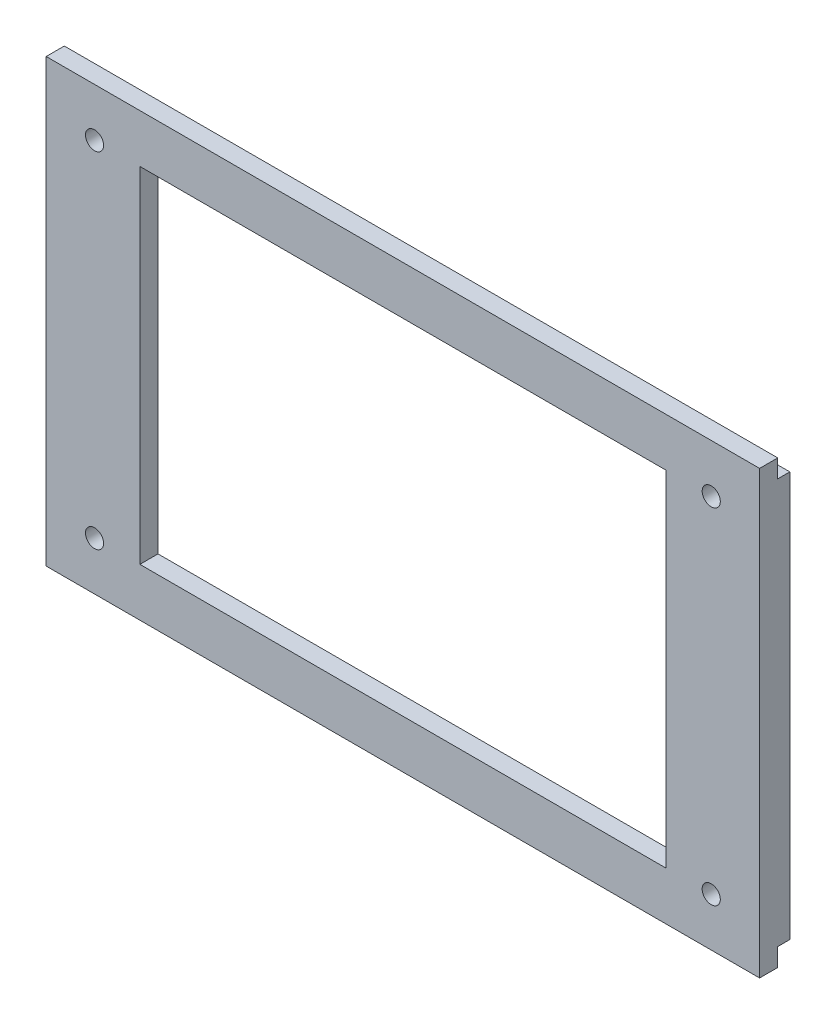
from build123d import *

# Parameters (mm, degrees)
SKETCH_1_R      = 1.5
SKETCH_1_W      = 87
SKETCH_1_H      = 57
EXTRUDE_2_DEPTH = 3
SKETCH_3_W      = 3
SKETCH_3_H      = 67
EXTRUDE_3_DEPTH = 2


with BuildPart() as part:
    # 草图1 → 凸台-拉伸2 (new body)
    with BuildSketch(Plane.XY):
        Polygon((-11.864484676, 21.655738596), (-19.864484676, 21.655738596), (-19.864484676, 10.655738596), (-19.864484676, -51.344261404), (-14.864484676, -51.344261404), (-11.864484676, -51.344261404), (98.135515324, -51.344261404), (98.135515324, -43.344261404), (98.135515324, 10.655738596), (98.135515324, 21.655738596), (-4.364484676, 21.655738596), (-6.864484676, 21.655738596), (-7.364484676, 21.655738596), align=None)
        with Locations((-11.864484676, -43.344261404)):
            Circle(SKETCH_1_R, mode=Mode.SUBTRACT)
        with Locations((90.135515324, -43.344261404)):
            Circle(SKETCH_1_R, mode=Mode.SUBTRACT)
        with Locations((-11.864484676, 13.655738596)):
            Circle(SKETCH_1_R, mode=Mode.SUBTRACT)
        with Locations((39.135515324, -14.844261404)):
            Rectangle(SKETCH_1_W, SKETCH_1_H, mode=Mode.SUBTRACT)
        with Locations((90.135515324, 13.655738596)):
            Circle(SKETCH_1_R, mode=Mode.SUBTRACT)
    extrude(amount=EXTRUDE_2_DEPTH)

    # 草图3 → 凸台-拉伸3 (add)
    with BuildSketch(Plane(origin=(0, 0, 0), x_dir=(-1, 0, 0), z_dir=(0, 0, -1))):
        with Locations((-96.635515324, -14.844261404)):
            Rectangle(SKETCH_3_W, SKETCH_3_H)
    extrude(amount=EXTRUDE_3_DEPTH)


solid = part.part
